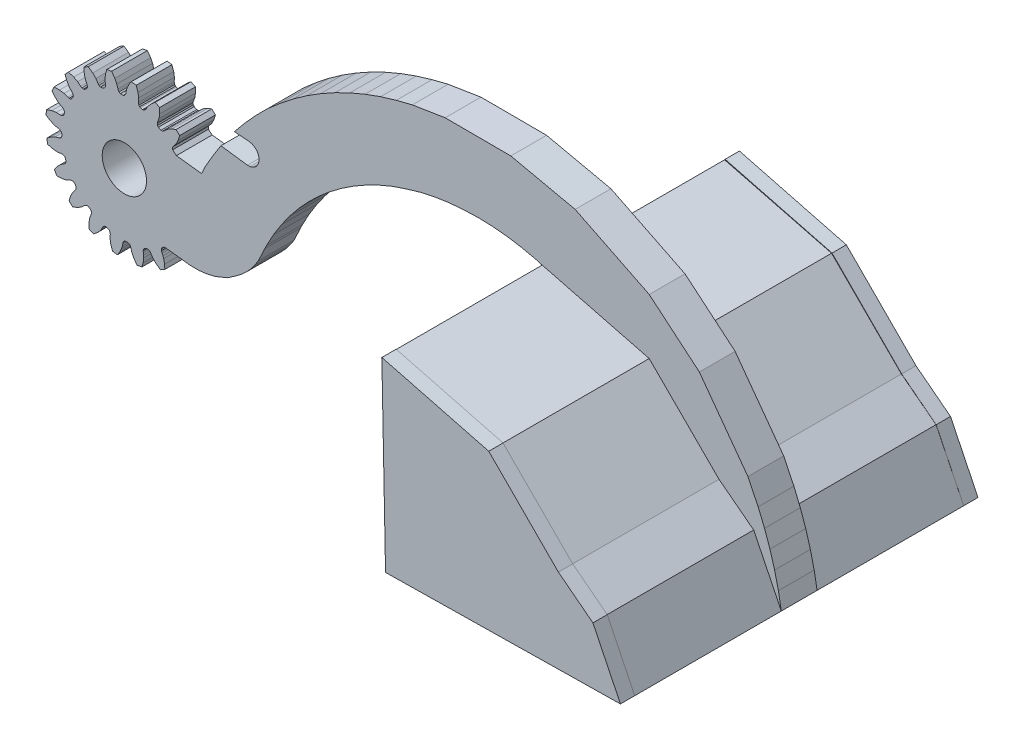
from build123d import *

# Parameters (mm, degrees)
EXTRUDE_2_DEPTH      = 5
EXTRUDE_3_DEPTH      = 27.5
EXTRUDE_3_DEPTH_BACK = 22.5
SKETCH_11_R          = 3.100000994
EXTRUDE_5_DEPTH      = 22.5
EXTRUDE_6_DEPTH      = 2
EXTRUDE_7_DEPTH      = 2


with BuildPart() as part:
    # 草图6 → 凸台-拉伸2 (new body)
    with BuildSketch(Plane.XY):
        Polygon((76.215757706, 126.691862129), (76.406745911, 126.759757996), (76.638504028, 126.721138), (78.936172485, 126.458847046), (79.878005859, 126.332787124), (81.186029795, 126.332787124), (82.205654892, 126.458847046), (83.369479409, 126.724569635), (84.20225382, 127.05873707), (85.086408647, 127.415950536), (86.083607382, 128.092379293), (86.960287749, 128.739542343), (87.754204482, 129.449504002), (88.393272959, 130.149954535), (88.953127217, 130.892375058), (89.443749627, 131.652533209), (90.342789885, 133.57791102), (90.600956072, 134.101837399), (91.568132566, 135.883263594), (92.642851667, 137.601941441), (93.821069625, 139.251394916), (95.09832053, 140.825406747), (96.469823048, 142.318022487), (97.930370774, 143.723622675), (99.47445538, 145.036897), (101.096264873, 146.252890043), (102.789668338, 147.367000691), (104.548289279, 148.375061292), (106.365478603, 149.273244996), (108.234372131, 150.058159577), (110.19430894, 150.715667328), (112.098960702, 151.276793996), (114.080057771, 151.705910334), (116.083768661, 152.012585117), (118.069891096, 152.175906953), (120.128711533, 152.254460258), (122.154693372, 152.188742816), (124.172811617, 151.998749093), (126.17545681, 151.685211835), (128.155070653, 151.249323839), (129.129632076, 150.971008896), (144.091168645, 147.137568053), (153.858655794, 137.397342253), (158.701339576, 133.681168531), (162.571515473, 125.797583916), (162.160841267, 128.060732389), (161.629747942, 130.298687244), (160.979740104, 132.505031455), (160.224773943, 134.643540264), (159.33078754, 136.797776705), (157.898775534, 139.750574675), (151.106121626, 149.018564485), (144.097601926, 154.901893043), (133.737020275, 160.025502982), (124.740396564, 162.000363377), (115.567011359, 162.031685431), (110.971602243, 161.295162806), (108.735320149, 160.733107305), (106.52719888, 160.065440749), (104.358061753, 159.280309158), (102.234151563, 158.379981619), (100.161584528, 157.367043056), (98.14631101, 156.244423273), (96.194148337, 155.015337127), (94.310718062, 153.683327942), (92.501416639, 152.25223585), (90.736697629, 150.723010228), (89.125586596, 149.112989812), (87.569314936, 147.406950706), (86.101487426, 145.623760569), (88.163907235, 145.454369716), (88.518107578, 145.381532822), (88.804358062, 145.226737906), (89.124366396, 144.996973499), (89.341199988, 144.707590683), (89.482473493, 144.374706996), (89.539980307, 144.017707479), (89.51037995, 143.657308081), (89.410356169, 143.342123361), (89.189328159, 142.990584803), (88.955665257, 142.771967471), (88.62714359, 142.578613587), (88.27966481, 142.478485288), (87.918335416, 142.464424081), (84.20225382, 142.968310871), (83.129804164, 141.262611188), (82.073521577, 139.450982577), (81.496315002, 138.237457275), (77.983535767, 138.65663147), (77.457138062, 139.096343994), (77.457138062, 139.450982577), (77.562988281, 139.583221436), (77.921844482, 140.025283813), (78.204971313, 140.5809021), (78.437263489, 141.315216064), (77.927955627, 141.787765503), (77.339637756, 141.561767578), (76.789276123, 141.255371094), (76.352958679, 140.867462158), (76.235635001, 140.763155297), (76.031280518, 140.653182983), (75.814163208, 140.638702393), (75.466567993, 140.835266113), (75.345069885, 140.995285034), (75.310173035, 141.227630615), (75.344978333, 141.404464722), (75.549659729, 141.935775757), (75.647232056, 142.551696777), (75.647232056, 143.325297089), (75.004499421, 143.61486791), (74.521156311, 143.217163086), (74.092407227, 142.755691528), (73.919281443, 142.50974437), (73.797317505, 142.251922607), (73.71913147, 142.116897583), (73.453895471, 141.898655854), (73.355575562, 141.867858887), (73.25533514, 141.867858887), (72.964256287, 141.947387695), (72.859966188, 142.007776718), (72.742012024, 142.145797729), (72.697608711, 142.28755616), (72.672721863, 142.451171875), (72.703201294, 143.019729614), (72.605667114, 143.635650635), (72.361976624, 144.366256714), (71.672180176, 144.449203491), (71.329071045, 143.920562744), (71.063911438, 143.349182129), (70.9766922, 143.052810669), (70.910142394, 142.632717949), (70.864601135, 142.516937256), (70.804634094, 142.41645813), (70.7240448, 142.331741333), (70.637496948, 142.277130127), (70.548576355, 142.247802734), (70.240753174, 142.231842041), (70.140001999, 142.247802734), (69.964150399, 142.352752892), (69.883598328, 142.457351685), (69.807807922, 142.620864868), (69.650621612, 143.166354082), (69.378013611, 143.726654053), (68.920478821, 144.346206665), (68.236306826, 144.210074373), (68.075843811, 143.603134155), (68.000228882, 142.977783203), (68.008865356, 142.668960571), (68.057601929, 142.396774292), (68.07371521, 142.241592407), (68.05846391, 142.115461029), (68.045443155, 142.007776718), (67.991416931, 141.905105591), (67.915404392, 141.825199955), (67.850471497, 141.771057129), (67.562644958, 141.660751343), (67.461021423, 141.645828247), (67.361763, 141.656509399), (67.267117549, 141.693737307), (67.153282166, 141.764862061), (67.030670166, 141.896957397), (66.72114563, 142.374847412), (66.280212402, 142.815811157), (65.653617859, 143.263641357), (65.046813965, 142.925292969), (65.079948425, 142.295944214), (65.201278687, 141.677825928), (65.435379028, 141.142990112), (65.529212952, 140.887359619), (65.524360657, 140.654922485), (65.486442566, 140.559875488), (65.431747437, 140.483886719), (65.192092896, 140.290039063), (65.10005466, 140.244442956), (65.002353633, 140.223928796), (64.900836404, 140.230087587), (64.770593763, 140.262554179), (64.613163118, 140.350295119), (64.171111655, 140.709147189), (63.615493944, 140.992272772), (62.881179978, 141.224556239), (62.408630583, 140.715255084), (62.634622788, 140.126947961), (62.941023778, 139.57657565), (63.13468663, 139.327574661), (63.327681668, 139.134579623), (63.433189392, 139.024169922), (63.497175321, 138.926134777), (63.564387539, 138.703574485), (63.557696429, 138.601462084), (63.529160091, 138.512290745), (63.361137298, 138.253873343), (63.287693706, 138.18206749), (63.201113732, 138.132366086), (63.102661938, 138.106852896), (62.968761097, 138.09748327), (62.791922215, 138.132281118), (62.260614902, 138.336968303), (61.644700441, 138.434541419), (60.87454682, 138.428540629), (60.58250835, 137.798140653), (60.979236609, 137.308462762), (61.440715665, 136.879710702), (61.701845519, 136.702741802), (61.945033454, 136.57883136), (62.079495736, 136.506429174), (62.170644497, 136.43296495), (62.303342027, 136.242067251), (62.32853287, 136.142884921), (62.328948659, 136.049259724), (62.249004856, 135.751568271), (62.201345079, 135.660581529), (62.134361208, 135.586558002), (62.048611998, 135.531870239), (61.924160104, 135.481581559), (61.745223206, 135.460030059), (61.176668105, 135.490516152), (60.560746893, 135.392985664), (59.830141619, 135.149288017), (59.747200835, 134.459497161), (60.275830621, 134.116381586), (60.847214957, 133.851219017), (61.150250604, 133.763605154), (61.419826507, 133.720908525), (61.570081243, 133.693601084), (61.679470559, 133.651898971), (61.864664043, 133.511350263), (61.919270984, 133.42480666), (61.9485982, 133.335892293), (61.964558843, 133.028066903), (61.947348151, 132.926805687), (61.906517232, 132.835705975), (61.841864335, 132.757196858), (61.739043607, 132.670911732), (61.575524284, 132.595120495), (61.02537553, 132.448421304), (60.469738226, 132.165334176), (59.850198033, 131.707794495), (59.984473757, 131.026134295), (60.593259103, 130.863167579), (61.21861764, 130.787550459), (61.533895839, 130.797867889), (61.803471742, 130.840564517), (61.954810951, 130.861024865), (62.071733034, 130.855166956), (62.291294444, 130.778725125), (62.369972175, 130.71329174), (62.425340065, 130.63779176), (62.531270916, 130.350798081), (62.546194012, 130.249174546), (62.53551286, 130.149916123), (62.498284952, 130.055270672), (62.427160198, 129.941435288), (62.295064862, 129.818823288), (61.817174847, 129.509298752), (61.376211102, 129.068365525), (60.928380902, 128.441770981), (61.26672929, 127.834967087), (61.896078045, 127.868101548), (62.514196331, 127.989431809), (62.810855456, 128.096670589), (63.054043391, 128.220581031), (63.191652937, 128.286806365), (63.30466264, 128.317366074), (63.537099774, 128.312513779), (63.632146771, 128.274595688), (63.70813554, 128.219900559), (63.901983197, 127.980246018), (63.950844081, 127.891237153), (63.971358241, 127.793536125), (63.96519945, 127.692018896), (63.932732858, 127.561776255), (63.844991919, 127.40434561), (63.486139848, 126.962294147), (63.203014265, 126.406676437), (62.970730798, 125.67236247), (63.480031953, 125.199813075), (64.068339076, 125.42580528), (64.618711387, 125.732206271), (64.867712376, 125.925869122), (65.060707414, 126.11886416), (65.171117115, 126.224371885), (65.26915226, 126.288357813), (65.491712552, 126.355570031), (65.593824953, 126.348878921), (65.682996292, 126.320342583), (65.941413694, 126.15231979), (66.013219547, 126.078876199), (66.062920951, 125.992296224), (66.088434141, 125.89384443), (66.097803767, 125.759943589), (66.063005919, 125.583104707), (65.858318734, 125.051797394), (65.760745618, 124.435882934), (65.766746408, 123.665729312), (66.397146384, 123.373690843), (66.886824275, 123.770419101), (67.315576335, 124.231898157), (67.492545235, 124.493028011), (67.616455677, 124.736215946), (67.688857863, 124.870678229), (67.762322087, 124.961826989), (67.953219786, 125.094524519), (68.052402116, 125.119715363), (68.146027313, 125.120131152), (68.444369418, 125.032129842), (68.535356161, 124.984470065), (68.609379688, 124.917486194), (68.664067451, 124.831736983), (68.71435613, 124.70728509), (68.73590763, 124.528348192), (68.705421538, 123.959793091), (68.802952026, 123.343871879), (69.046649673, 122.613266605), (69.736440528, 122.530325821), (70.079556103, 123.058955607), (70.344718673, 123.630339943), (70.432332536, 123.93337559), (70.475029165, 124.202951493), (70.502336605, 124.353206229), (70.544038718, 124.462595545), (70.684587426, 124.647789029), (70.771131029, 124.70239597), (70.860045397, 124.731723185), (71.167870787, 124.747683829), (71.269132002, 124.730473137), (71.360231714, 124.689642218), (71.438740831, 124.62498932), (71.525025957, 124.522168592), (71.600817195, 124.35864927), (71.747516386, 123.808500515), (72.030603514, 123.252863212), (72.488143195, 122.633323019), (73.169803395, 122.767598743), (73.332770111, 123.376384089), (73.40838723, 124.001742626), (73.398069801, 124.317020825), (73.355373172, 124.586596728), (73.334912825, 124.737935937), (73.340770733, 124.85485802), (73.417212564, 125.074419429), (73.482645949, 125.153097161), (73.558145929, 125.208465051), (73.856527225, 125.322812388), (73.946829178, 125.336072945), (74.046087601, 125.325391793), (74.140733052, 125.288163884), (74.254568436, 125.217039131), (74.377180436, 125.084943794), (74.686704972, 124.60705378), (75.127638199, 124.166090035), (75.754232743, 123.718259834), (76.361036637, 124.056608223), (76.327902176, 124.685956978), (76.206571915, 125.304075264), (76.099333135, 125.600734389), (75.975422693, 125.843922324), (75.909197359, 125.98153187), (75.87863765, 126.094541573), (75.883489945, 126.326978707), (75.921408036, 126.422025704), (75.976103165, 126.498014473), align=None)
    extrude(amount=EXTRUDE_2_DEPTH)

    # 草图8 → 凸台-拉伸3 (add, two sides: drawn at the far end of the back side and taken through both)
    with BuildSketch(Plane.XY.offset(-EXTRUDE_3_DEPTH_BACK)):
        Polygon((158.702440135, 133.681708717), (162.571515473, 125.797583916), (160.631116337, 128.758577005), (159.274367323, 130.581035985), (158.105801727, 131.892269462), (156.337475004, 133.428305217), (154.666752037, 134.710753504), (153.631686267, 135.672621834), (152.120523456, 137.33242225), (150.701939151, 138.806543783), (147.799461269, 141.365736602), (145.205059424, 143.253899381), (143.231739803, 144.489359813), (141.138914847, 145.638204846), (138.394476414, 146.923476222), (137.453930938, 147.311203172), (135.680648687, 148.345623136), (133.90397791, 149.225530099), (131.434707716, 150.228184204), (129.133146525, 150.975677022), (144.094147814, 147.140147638), (153.860275165, 137.398558425), align=None)
    extrude(amount=EXTRUDE_3_DEPTH + EXTRUDE_3_DEPTH_BACK)


with BuildPart() as body_2:
    # 草图11 → 凸台-拉伸5 (new body)
    with BuildSketch(Plane(origin=(0, 0, 0), x_dir=(-1, 0, 0), z_dir=(0, 0, -1))):
        with Locations((-70.704543782, 133.491844167)):
            Circle(SKETCH_11_R)
    extrude(amount=-EXTRUDE_5_DEPTH)


with BuildPart() as part_1:
    add(part.part)

    # Combine 2: cut body 2
    add(body_2.part, mode=Mode.SUBTRACT)

    # 草图14 → 凸台-拉伸6 (add)
    with BuildSketch(Plane.XY.offset(27.5)):
        Polygon((129.727581099, 125.302747628), (162.571515473, 125.797583916), (158.726819245, 133.693625884), (153.89616184, 137.425419338), (144.160181006, 147.197137766), (129.211102286, 151.078875859), align=None)
    extrude(amount=-EXTRUDE_6_DEPTH)

    # 草图15 → 凸台-拉伸7 (add)
    with BuildSketch(Plane(origin=(0, 0, -22.5), x_dir=(-1, 0, 0), z_dir=(0, 0, -1))):
        Polygon((-129.213583285, 150.955055571), (-129.211102286, 151.078875859), (-144.160181006, 147.197137766), (-153.89616184, 137.425419338), (-158.726819245, 133.693625884), (-162.571515473, 125.797583916), (-129.727581099, 125.302747628), (-129.213694262, 150.949517016), (-129.133146525, 150.975677022), align=None)
    extrude(amount=-EXTRUDE_7_DEPTH)


solid = part_1.part
